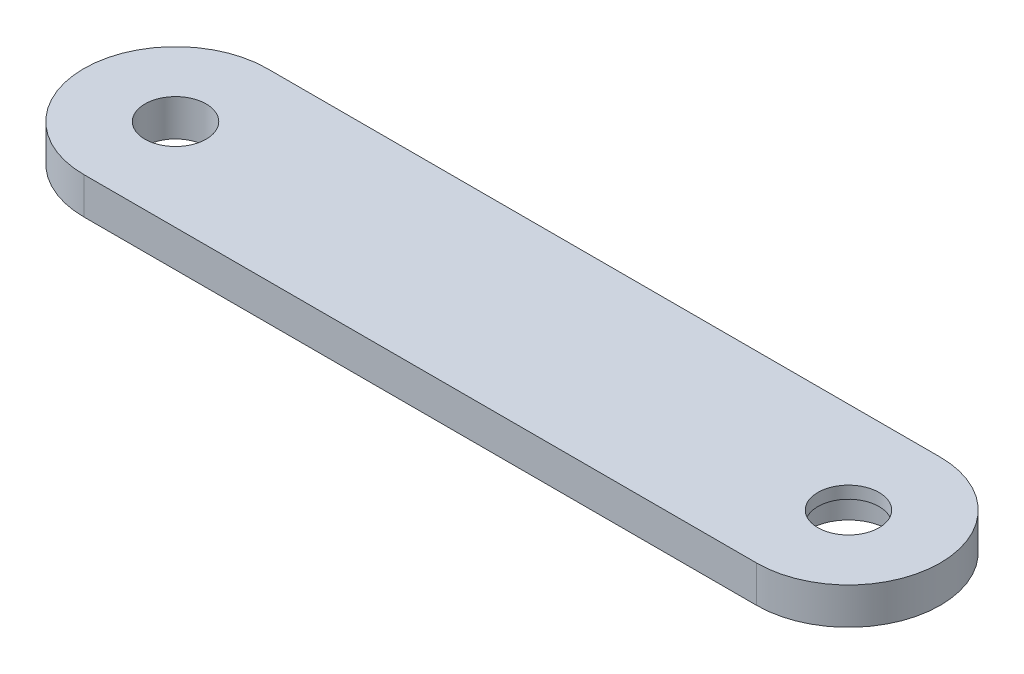
from build123d import *

# Parameters (mm, degrees)
SKETCH2_R           = 5
BOSS_EXTRUDE1_DEPTH = 6
SKETCH3_R           = 6.5
CUT_EXTRUDE1_DEPTH  = 4


with BuildPart() as part:
    # Sketch2 → Boss-Extrude1 (new body)
    with BuildSketch(Plane(origin=(0, 0, 0), x_dir=(1, 0, 0), z_dir=(0, 1, 0))):
        with BuildLine():
            Line((-45, 15), (65, 15))
            ThreePointArc((65, 15), (80, 0), (65, -15))
            Line((65, -15), (-45, -15))
            ThreePointArc((-45, -15), (-60, 0), (-45, 15))
        make_face()
        with Locations(Location((-45, 0, 0), (0, 0, 270))):
            Circle(SKETCH2_R, mode=Mode.SUBTRACT)
        with Locations(Location((65, 0, 0), (0, 0, 270))):
            Circle(SKETCH2_R, mode=Mode.SUBTRACT)
    extrude(amount=BOSS_EXTRUDE1_DEPTH)

    # Sketch3 → Cut-Extrude1 (cut)
    with BuildSketch(Plane.XZ):
        with Locations(Location((65, 0, 0), (0, 0, 270))):
            Circle(SKETCH3_R)
    extrude(amount=-CUT_EXTRUDE1_DEPTH, mode=Mode.SUBTRACT)


solid = part.part
